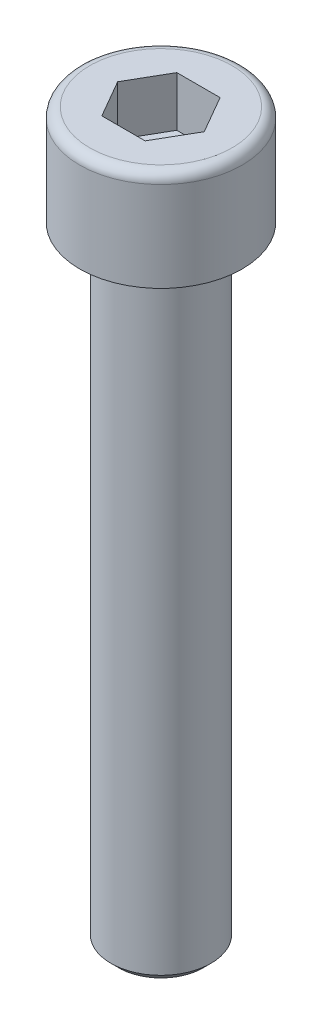
from build123d import *

# Parameters (mm, degrees)
CUT_EXTRUDE1_DEPTH = 4
FILLET3_R          = 0.8
CHAMFER1_SIZE      = 0.625


with BuildPart() as part:
    # Sketch1 → Revolve1 (revolve)
    with BuildSketch(Plane.XY, mode=Mode.PRIVATE) as revolve1_sk:
        Polygon((0, 0), (6.5, 0), (6.5, -8), (4, -8), (4, -58), (0, -58), align=None)
    revolve(revolve1_sk.sketch.rotate(Axis((0, -63, 0), (0, 1, 0)), 90), axis=Axis((0, -63, 0), (0, 1, 0)))

    # Sketch2 → Cut-Extrude1 (cut)
    with BuildSketch(Plane(origin=(0, 0, 0), x_dir=(1, 0, 0), z_dir=(0, 1, 0))):
        Polygon((3.464101615, 0), (1.732050808, 3), (-1.732050808, 3), (-3.464101615, 0), (-1.732050808, -3), (1.732050808, -3), align=None)
    extrude(amount=-CUT_EXTRUDE1_DEPTH, mode=Mode.SUBTRACT)

    # Fillet3
    fillet3_edges = [part.edges().sort_by_distance(p)[0] for p in [
        (0, 0, 6.5),
    ]]
    fillet(fillet3_edges, radius=FILLET3_R)

    # Chamfer1
    chamfer1_edges = [part.edges().sort_by_distance(p)[0] for p in [
        (0, -58, 4),
    ]]
    chamfer(chamfer1_edges, length=CHAMFER1_SIZE)


solid = part.part
